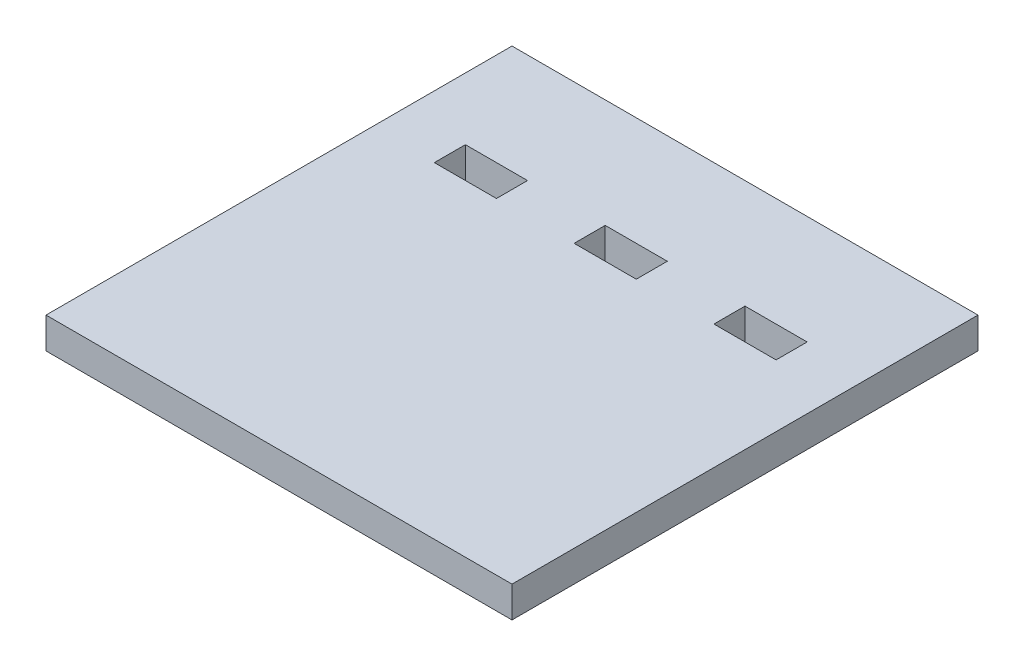
from build123d import *

# Parameters (mm, degrees)
SKETCH1_W           = 150
SKETCH1_H           = 150
SKETCH1_W_2         = 20
SKETCH1_H_2         = 10
BOSS_EXTRUDE1_DEPTH = 10


with BuildPart() as part:
    # Sketch1 → Boss-Extrude1 (new body)
    with BuildSketch(Plane(origin=(0, 0, 0), x_dir=(1, 0, 0), z_dir=(0, 1, 0))):
        Rectangle(SKETCH1_W, SKETCH1_H)
        with Locations((-45, 35)):
            Rectangle(SKETCH1_W_2, SKETCH1_H_2, mode=Mode.SUBTRACT)
        with Locations((0, 35)):
            Rectangle(SKETCH1_W_2, SKETCH1_H_2, mode=Mode.SUBTRACT)
        with Locations((45, 35)):
            Rectangle(SKETCH1_W_2, SKETCH1_H_2, mode=Mode.SUBTRACT)
    extrude(amount=BOSS_EXTRUDE1_DEPTH)


solid = part.part
